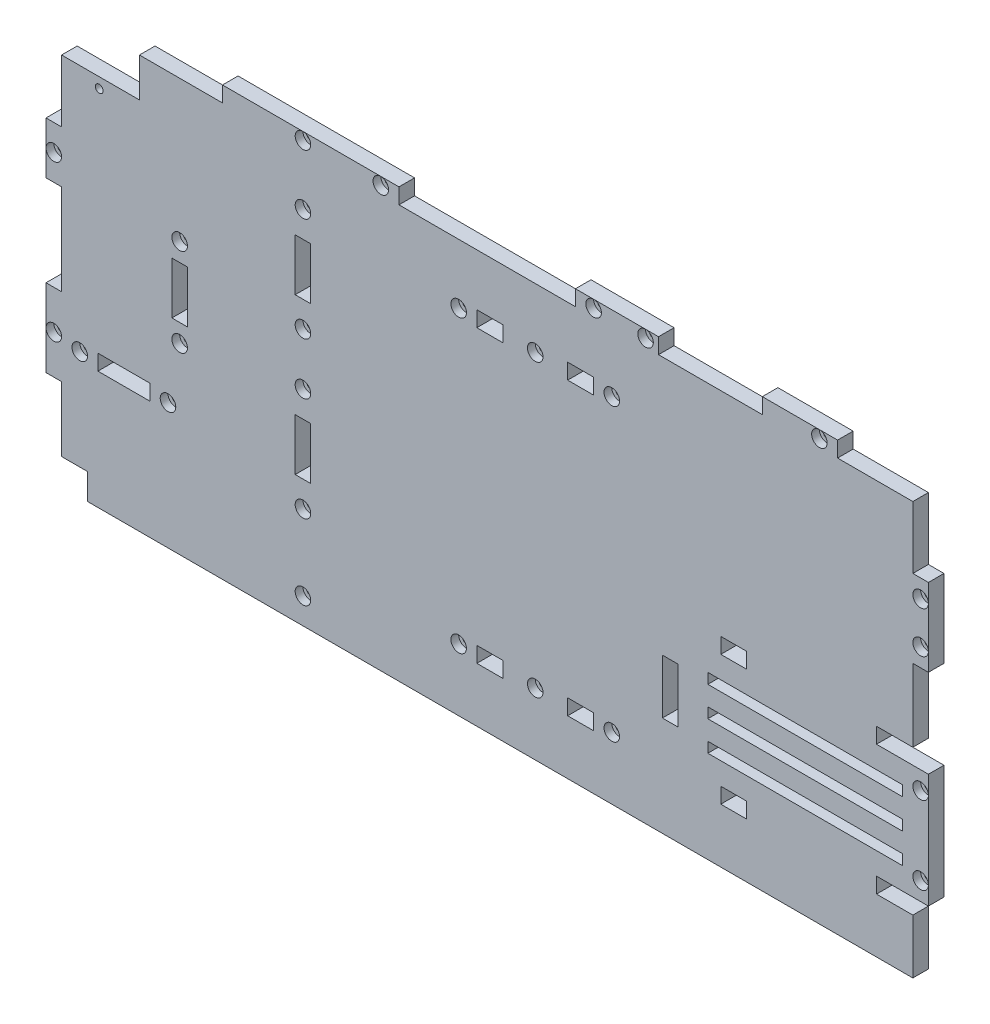
from build123d import *

# Parameters (mm, degrees)
ESQUISSE1_W             = 340
ESQUISSE1_H             = 148
BOSS_EXTRU_1_DEPTH      = 6
ESQUISSE2_W             = 6
ESQUISSE2_H             = 10
ESQUISSE2_H_2           = 35
ESQUISSE2_H_3           = 18
ESQUISSE2_W_2           = 68
ESQUISSE2_H_4           = 6
ESQUISSE2_H_5           = 34
ESQUISSE2_W_3           = 40
ENL_V_MAT_EXTRU_1_DEPTH = 6
ESQUISSE3_W             = 6
ESQUISSE3_H             = 20
ESQUISSE3_W_2           = 30
ESQUISSE3_H_2           = 15
ESQUISSE3_W_3           = 20
ESQUISSE3_H_3           = 6
ENL_V_MAT_EXTRU_2_DEPTH = 10
ESQUISSE4_R             = 1.5
ESQUISSE4_W             = 10
ESQUISSE4_H             = 6
ENL_V_MAT_EXTRU_3_DEPTH = 10
ESQUISSE7_W             = 328
ESQUISSE7_H             = 6
BOSS_EXTRU_2_DEPTH      = 17
ESQUISSE8_R             = 1.5
ESQUISSE8_W             = 10
ESQUISSE8_H             = 10
ENL_V_MAT_EXTRU_5_DEPTH = 371.863856422
ESQUISSE9_R             = 2.995
ESQUISSE9_R_2           = 3
ENL_V_MAT_EXTRU_8_DEPTH = 3
ESQUISSE10_W            = 14
ESQUISSE10_H            = 6
ESQUISSE10_W_2          = 10
ESQUISSE10_W_3          = 75
ESQUISSE10_H_2          = 4
ESQUISSE10_W_4          = 6
ESQUISSE10_H_3          = 21
ENL_V_MAT_EXTRU_9_DEPTH = 371.863856422


with BuildPart() as part:
    # Esquisse1 → Boss.-Extru.1 (new body)
    with BuildSketch(Plane.XY):
        with Locations((-170, 74)):
            Rectangle(ESQUISSE1_W, ESQUISSE1_H)
    extrude(amount=BOSS_EXTRU_1_DEPTH)

    # Esquisse2 → Enlèv. mat.-Extru.1 (cut)
    with BuildSketch(Plane.XY.offset(6)):
        Polygon((-272, 142), (-334, 142), (-334, 103), (-340, 103), (-340, 148), (-272, 148), align=None)
        Polygon((0, 148), (0, 118), (-6, 118), (-6, 142), (-35, 142), (-35, 148), align=None)
        with Locations((-3, 5)):
            Rectangle(ESQUISSE2_W, ESQUISSE2_H)
        with Locations((-337, 65.5)):
            Rectangle(ESQUISSE2_W, ESQUISSE2_H_2)
        with Locations((-337, 9)):
            Rectangle(ESQUISSE2_W, ESQUISSE2_H_3)
        with Locations((-170, 145)):
            Rectangle(ESQUISSE2_W_2, ESQUISSE2_H_4)
        with Locations((-3, 71)):
            Rectangle(ESQUISSE2_W, ESQUISSE2_H_5)
        with Locations((-84, 145)):
            Rectangle(ESQUISSE2_W_3, ESQUISSE2_H_4)
    extrude(amount=-ENL_V_MAT_EXTRU_1_DEPTH, mode=Mode.SUBTRACT)

    # Esquisse3 → Enlèv. mat.-Extru.2 (cut)
    with BuildSketch(Plane.XY.offset(6)):
        with Locations((-241, 42)):
            Rectangle(ESQUISSE3_W, ESQUISSE3_H)
        with Locations((-241, 102)):
            Rectangle(ESQUISSE3_W, ESQUISSE3_H)
        with Locations((-288.5, 70.5)):
            Rectangle(ESQUISSE3_W, ESQUISSE3_H)
        with Locations((-319, 134.5)):
            Rectangle(ESQUISSE3_W_2, ESQUISSE3_H_2)
        with Locations((-310, 31.5)):
            Rectangle(ESQUISSE3_W_3, ESQUISSE3_H_3)
    extrude(amount=-ENL_V_MAT_EXTRU_2_DEPTH, mode=Mode.SUBTRACT)

    # Esquisse4 → Enlèv. mat.-Extru.3 (cut)
    with BuildSketch(Plane.XY.offset(6)):
        with Locations((-151.5, 119)):
            Circle(ESQUISSE4_R)
        with Locations((-151.5, 7)):
            Circle(ESQUISSE4_R)
        with Locations((-169, 119)):
            Rectangle(ESQUISSE4_W, ESQUISSE4_H)
        with Locations((-134, 119)):
            Rectangle(ESQUISSE4_W, ESQUISSE4_H)
        with Locations((-134, 7)):
            Rectangle(ESQUISSE4_W, ESQUISSE4_H)
        with Locations((-169, 7)):
            Rectangle(ESQUISSE4_W, ESQUISSE4_H)
    extrude(amount=-ENL_V_MAT_EXTRU_3_DEPTH, mode=Mode.SUBTRACT)

    # Esquisse7 → Boss.-Extru.2 (add)
    with BuildSketch(Plane.XZ):
        with Locations((-170, 3)):
            Rectangle(ESQUISSE7_W, ESQUISSE7_H)
    extrude(amount=BOSS_EXTRU_2_DEPTH)

    # Esquisse8 → Enlèv. mat.-Extru.5 (cut, through all)
    with BuildSketch(Plane.XY.offset(6)):
        with Locations((-42, 145)):
            Circle(ESQUISSE8_R)
        with Locations((-129, 145)):
            Circle(ESQUISSE8_R)
        with Locations((-109, 145)):
            Circle(ESQUISSE8_R)
        with Locations((-3, 111)):
            Circle(ESQUISSE8_R)
        with Locations((-3, 95)):
            Circle(ESQUISSE8_R)
        with Locations((-3, 47)):
            Circle(ESQUISSE8_R)
        with Locations((-3, 17)):
            Circle(ESQUISSE8_R)
        with Locations((-122, 119)):
            Circle(ESQUISSE8_R)
        with Locations((-181, 119)):
            Circle(ESQUISSE8_R)
        with Locations((-122, 7)):
            Circle(ESQUISSE8_R)
        with Locations((-181, 7)):
            Circle(ESQUISSE8_R)
        with Locations((-211, 145)):
            Circle(ESQUISSE8_R)
        with Locations((-241, 145)):
            Circle(ESQUISSE8_R)
        with Locations((-241, 122)):
            Circle(ESQUISSE8_R)
        with Locations((-241, 82)):
            Circle(ESQUISSE8_R)
        with Locations((-241, 62)):
            Circle(ESQUISSE8_R)
        with Locations((-241, 22)):
            Circle(ESQUISSE8_R)
        with Locations((-241, -7)):
            Circle(ESQUISSE8_R)
        with Locations((-288.5, 87.5)):
            Circle(ESQUISSE8_R)
        with Locations((-288.5, 53.5)):
            Circle(ESQUISSE8_R)
        with Locations((-319.5, 123)):
            Circle(ESQUISSE8_R)
        with Locations((-293, 31.5)):
            Circle(ESQUISSE8_R)
        with Locations((-327, 31.5)):
            Circle(ESQUISSE8_R)
        with Locations((-337, 33)):
            Circle(ESQUISSE8_R)
        with Locations((-337, 93)):
            Circle(ESQUISSE8_R)
        with Locations((-329, -12)):
            Rectangle(ESQUISSE8_W, ESQUISSE8_H)
    extrude(amount=-ENL_V_MAT_EXTRU_5_DEPTH, mode=Mode.SUBTRACT)

    # Esquisse9 → Enlèv. mat.-Extru.8 (cut)
    with BuildSketch(Plane.XY.offset(6)):
        with Locations((-337, 33)):
            Circle(ESQUISSE9_R)
        with Locations((-327, 31.5)):
            Circle(ESQUISSE9_R_2)
        with Locations((-293, 31.5)):
            Circle(ESQUISSE9_R_2)
        with Locations((-288.5, 53.5)):
            Circle(ESQUISSE9_R_2)
        with Locations((-288.5, 87.5)):
            Circle(ESQUISSE9_R_2)
        with Locations((-241, 145)):
            Circle(ESQUISSE9_R)
        with Locations((-241, 122)):
            Circle(ESQUISSE9_R)
        with Locations((-241, 82)):
            Circle(ESQUISSE9_R)
        with Locations((-241, 62)):
            Circle(ESQUISSE9_R_2)
        with Locations((-241, 22)):
            Circle(ESQUISSE9_R_2)
        with Locations((-241, -7)):
            Circle(ESQUISSE9_R_2)
        with Locations((-211, 145)):
            Circle(ESQUISSE9_R)
        with Locations((-337, 93)):
            Circle(ESQUISSE9_R)
        with Locations((-181, 119)):
            Circle(ESQUISSE9_R)
        with Locations((-151.5, 119)):
            Circle(ESQUISSE9_R)
        with Locations((-129, 145)):
            Circle(ESQUISSE9_R)
        with Locations((-122, 119)):
            Circle(ESQUISSE9_R)
        with Locations((-109, 145)):
            Circle(ESQUISSE9_R)
        with Locations((-122, 7)):
            Circle(ESQUISSE9_R)
        with Locations((-151.5, 7)):
            Circle(ESQUISSE9_R)
        with Locations((-181, 7)):
            Circle(ESQUISSE9_R)
        with Locations((-42, 145)):
            Circle(ESQUISSE9_R)
        with Locations((-3, 111)):
            Circle(ESQUISSE9_R)
        with Locations((-3, 95)):
            Circle(ESQUISSE9_R)
        with Locations((-3, 47)):
            Circle(ESQUISSE9_R)
        with Locations((-3, 17)):
            Circle(ESQUISSE9_R)
    extrude(amount=-ENL_V_MAT_EXTRU_8_DEPTH, mode=Mode.SUBTRACT)

    # Esquisse10 → Enlèv. mat.-Extru.9 (cut, through all)
    with BuildSketch(Plane.XY.offset(6)):
        with Locations((-13, 57)):
            Rectangle(ESQUISSE10_W, ESQUISSE10_H)
        with Locations((-75, 57)):
            Rectangle(ESQUISSE10_W_2, ESQUISSE10_H)
        with Locations((-13, 7)):
            Rectangle(ESQUISSE10_W, ESQUISSE10_H)
        with Locations((-75, 7)):
            Rectangle(ESQUISSE10_W_2, ESQUISSE10_H)
        with Locations((-47.5, 43.5)):
            Rectangle(ESQUISSE10_W_3, ESQUISSE10_H_2)
        with Locations((-47.5, 32)):
            Rectangle(ESQUISSE10_W_3, ESQUISSE10_H_2)
        with Locations((-47.5, 20.5)):
            Rectangle(ESQUISSE10_W_3, ESQUISSE10_H_2)
        with Locations((-99.5, 32)):
            Rectangle(ESQUISSE10_W_4, ESQUISSE10_H_3)
    extrude(amount=-ENL_V_MAT_EXTRU_9_DEPTH, mode=Mode.SUBTRACT)


solid = part.part
